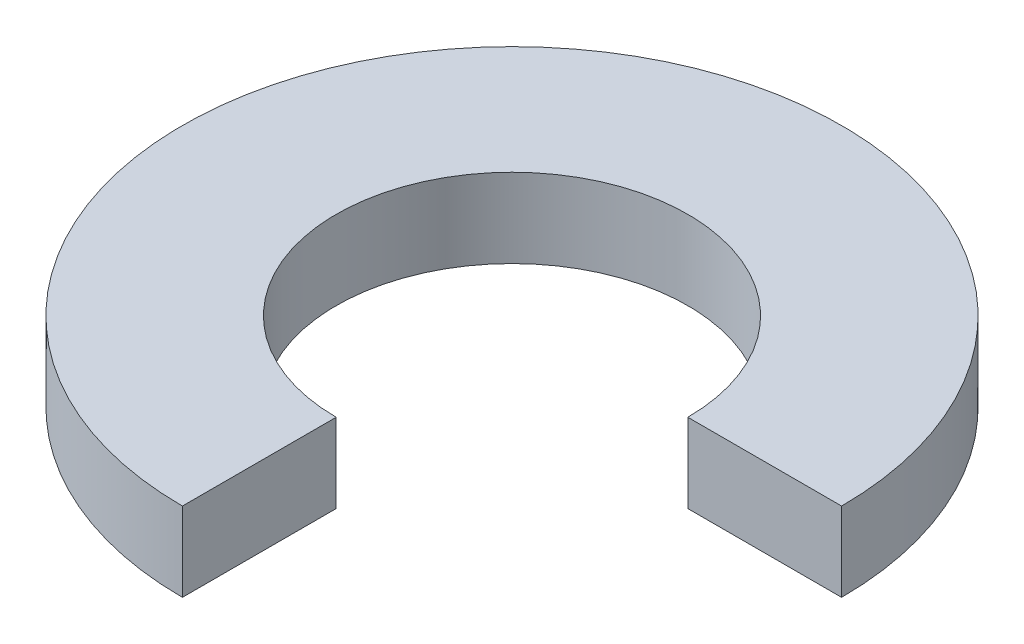
from build123d import *

# Parameters (mm, degrees)
SALIENTE_EXTRUIR1_DEPTH = 0.9


with BuildPart() as part:
    # Croquis1 → Saliente-Extruir1 (new body)
    with BuildSketch(Plane(origin=(0, 0, 0), x_dir=(1, 0, 0), z_dir=(0, 1, 0))):
        with BuildLine():
            Line((2, 0), (3.75, 0))
            ThreePointArc((3.75, 0), (-2.651650429, 2.651650429), (0, -3.75))
            Line((0, -3.75), (0, -2))
            ThreePointArc((0, -2), (-1.414213562, 1.414213562), (2, 0))
        make_face()
    extrude(amount=SALIENTE_EXTRUIR1_DEPTH)


solid = part.part
